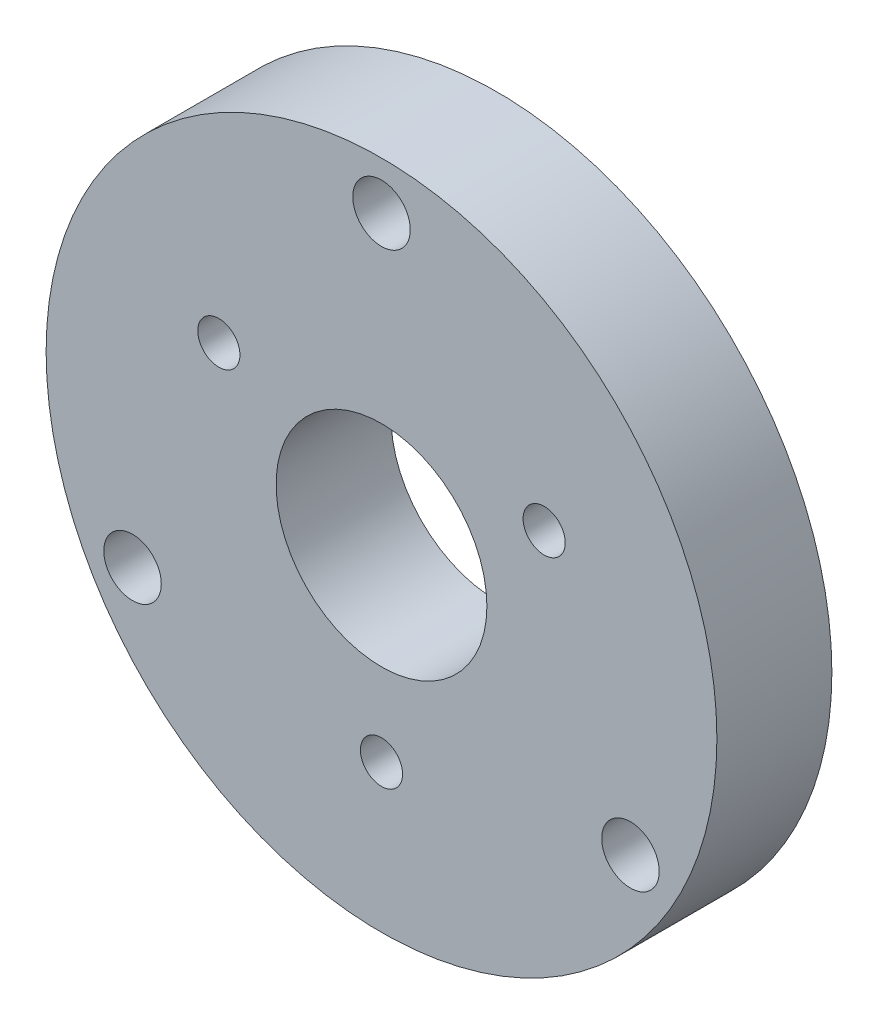
from build123d import *

# Parameters (mm, degrees)
SKETCH_1_R          = 17.5
SKETCH_1_R_2        = 1.5
SKETCH_1_R_3        = 5.5
EXTRUDE_1_DEPTH     = 6
SKETCH_2_R          = 1.1
CUT_EXTRUDE_1_DEPTH = 19


with BuildPart() as part:
    # 草图1 → 凸台-拉伸1 (new body)
    with BuildSketch(Plane.XY):
        Circle(SKETCH_1_R)
        with Locations((0, 15)):
            Circle(SKETCH_1_R_2, mode=Mode.SUBTRACT)
        with Locations((12.990381057, -7.5)):
            Circle(SKETCH_1_R_2, mode=Mode.SUBTRACT)
        with Locations((-12.990381057, -7.5)):
            Circle(SKETCH_1_R_2, mode=Mode.SUBTRACT)
        Circle(SKETCH_1_R_3, mode=Mode.SUBTRACT)
    extrude(amount=EXTRUDE_1_DEPTH)

    # 草图2 → 切除-拉伸1 (cut)
    with BuildSketch(Plane.XY):
        with Locations((-8.487048957, 4.9)):
            Circle(SKETCH_2_R)
        with Locations((8.487048957, 4.9)):
            Circle(SKETCH_2_R)
        with Locations((0, -9.8)):
            Circle(SKETCH_2_R)
    extrude(amount=CUT_EXTRUDE_1_DEPTH, mode=Mode.SUBTRACT)


solid = part.part
